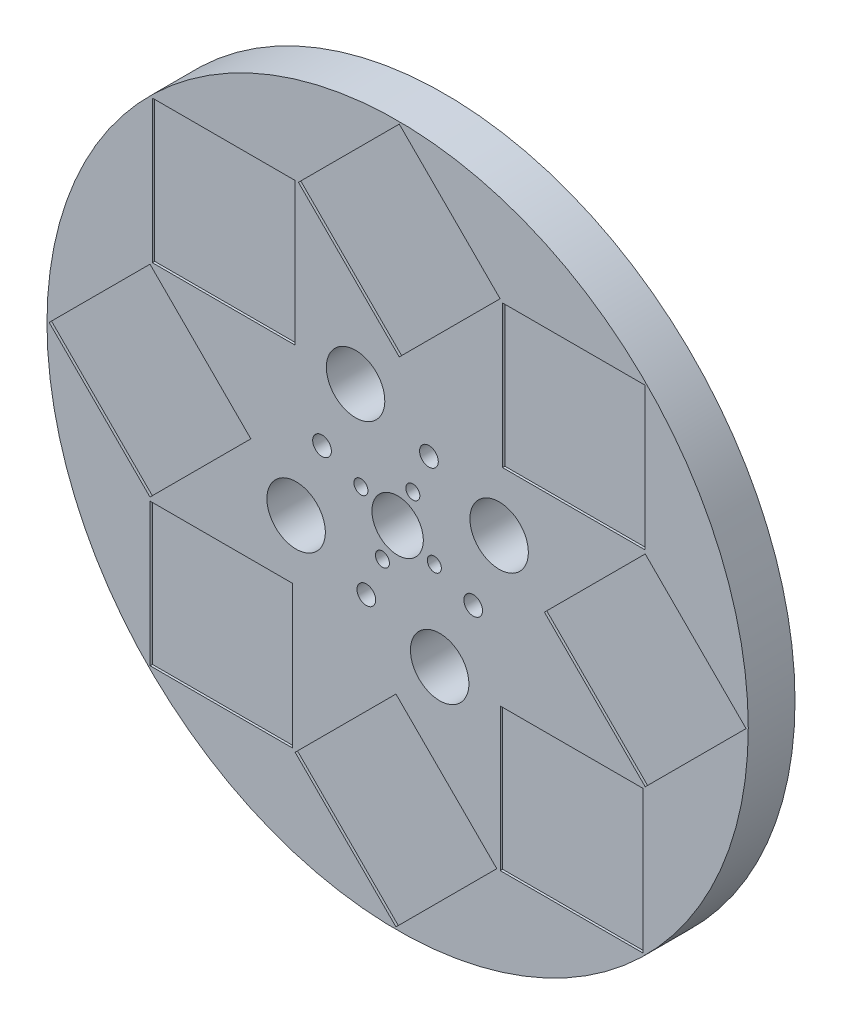
from build123d import *

# Parameters (mm, degrees)
SKETCH1_R             = 150
SKETCH1_R_2           = 11
BOSS_EXTRUDE1_DEPTH   = 20
F_6_0MM_DOWEL_HOLE1_D = 6
F_8_0MM_DOWEL_HOLE1_D = 8
CIRPATTERN2_COUNT     = 4
CUT_EXTRUDE2_DEPTH    = 1
CIRPATTERN3_COUNT     = 8
SKETCH2_R             = 12.5
CUT_EXTRUDE4_DEPTH    = 214.072757527
CIRPATTERN4_COUNT     = 4


with BuildPart() as part:
    # Sketch1 → Boss-Extrude1 (new body)
    with BuildSketch(Plane.XY):
        Circle(SKETCH1_R)
        Circle(SKETCH1_R_2, mode=Mode.SUBTRACT)
    extrude(amount=BOSS_EXTRUDE1_DEPTH)

    # Ø6.0mm Dowel Hole1 (through all)
    with Locations(Plane(origin=(0, 0, 0), x_dir=(-1, 0, 0), z_dir=(0, 0, -1))):
        with Locations((-15.705952053, -6.50561835)):
            f_6_0mm_dowel_hole1 = Hole(F_6_0MM_DOWEL_HOLE1_D / 2)

    # Ø8.0mm Dowel Hole1 (through all)
    with Locations(Plane(origin=(0, 0, 0), x_dir=(-1, 0, 0), z_dir=(0, 0, -1))):
        with Locations((-32.335783638, -13.393920133)):
            f_8_0mm_dowel_hole1 = Hole(F_8_0MM_DOWEL_HOLE1_D / 2)

    # CirPattern2: Ø6.0mm Dowel Hole1, Ø8.0mm Dowel Hole1 ×4 about axis
    cirpattern2_axis = Axis((0, 0, 0), (0, 0, 1))
    add([f_6_0mm_dowel_hole1.rotate(cirpattern2_axis, i * 360 / CIRPATTERN2_COUNT) for i in range(1, CIRPATTERN2_COUNT)], mode=Mode.SUBTRACT)
    add([f_8_0mm_dowel_hole1.rotate(cirpattern2_axis, i * 360 / CIRPATTERN2_COUNT) for i in range(1, CIRPATTERN2_COUNT)], mode=Mode.SUBTRACT)

    # Sketch9 → Cut-Extrude2 (cut)
    with BuildSketch(Plane.XY.offset(20)):
        Polygon((-42.426406871, 105.926406871), (0.707106781, 62.792893219), (43.840620434, 105.926406871), (0.707106781, 149.059920524), align=None)
    cut_extrude2 = extrude(amount=-CUT_EXTRUDE2_DEPTH, mode=Mode.SUBTRACT)

    # CirPattern3: Cut-Extrude2 ×8 about axis
    cirpattern3_axis = Axis((0, 0, 0), (0, 0, 1))
    for i in range(1, CIRPATTERN3_COUNT):
        add(cut_extrude2.rotate(cirpattern3_axis, i * 360 / CIRPATTERN3_COUNT), mode=Mode.SUBTRACT)

    # Sketch2 → Cut-Extrude4 (cut, through all)
    with BuildSketch(Plane.XY):
        with Locations((43.422338028, 17.986121321)):
            Circle(SKETCH2_R)
    cut_extrude4 = extrude(amount=CUT_EXTRUDE4_DEPTH, mode=Mode.SUBTRACT)

    # CirPattern4: Cut-Extrude4 ×4 about axis
    cirpattern4_axis = Axis((0, 0, 0), (0, 0, 1))
    for i in range(1, CIRPATTERN4_COUNT):
        add(cut_extrude4.rotate(cirpattern4_axis, i * 360 / CIRPATTERN4_COUNT), mode=Mode.SUBTRACT)


solid = part.part
